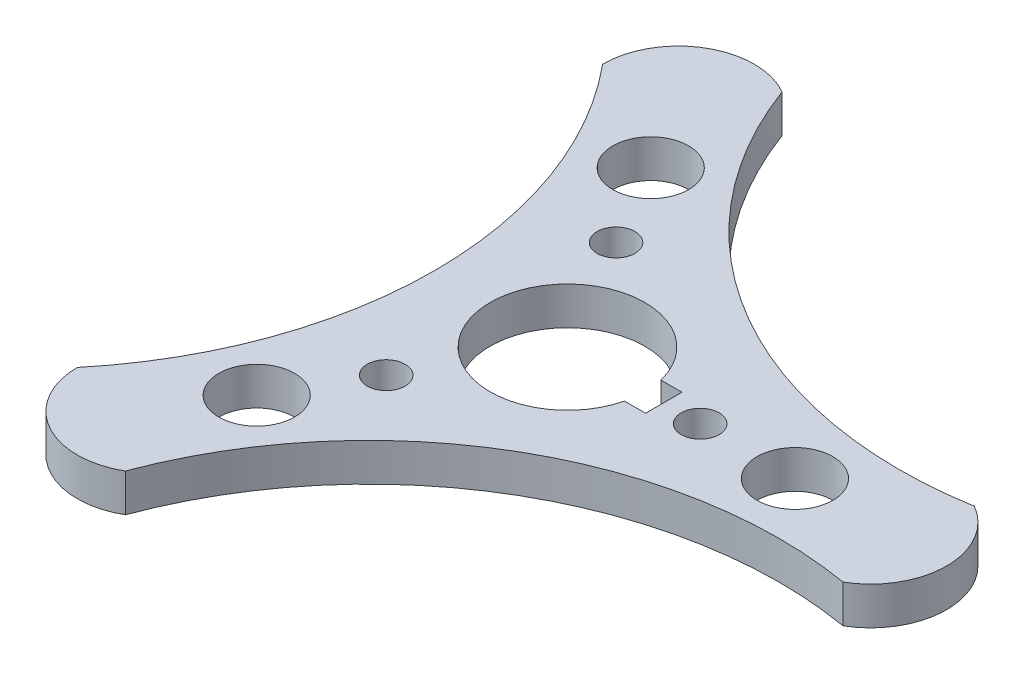
from build123d import *

# Parameters (mm, degrees)
BOSS_EXTRUDE2_DEPTH = 3.175


with BuildPart() as part:
    # Sketch1 → Boss-Extrude2 (new body)
    # profile 1 of 7: a face of its own
    with BuildSketch(Plane(origin=(0, 0, 0), x_dir=(1, 0, 0), z_dir=(0, 1, 0))):
        with BuildLine():
            ThreePointArc((28.575, -5.499261314), (31.75, 0), (28.575, 5.499261314))
            ThreePointArc((28.575, 5.499261314), (5.55625, 9.6237073), (-9.525, 27.49630657))
            ThreePointArc((-9.525, 27.49630657), (-15.875, 27.49630657), (-19.05, 21.997045256))
            ThreePointArc((-19.05, 21.997045256), (-11.443597622, 4.764679711), (-14.037901317, -13.892259152))
            Line((-14.037901317, -13.892259152), (-12.274630657, -14.910283942))
            ThreePointArc((-12.274630657, -14.910283942), (-11.1125, -13.748153285), (-9.525, -13.322783942))
            Line((-9.525, -13.322783942), (-9.525, 13.322783942))
            ThreePointArc((-9.525, 13.322783942), (-11.77006403, 18.742847972), (-6.35, 16.497783942))
            ThreePointArc((-6.35, 16.497783942), (-6.458185502, 15.676033474), (-6.775369343, 14.910283942))
            Line((-6.775369343, 14.910283942), (16.300369343, 1.5875))
            ThreePointArc((16.300369343, 1.5875), (19.871750468, 3.066814498), (22.225, 0))
            ThreePointArc((22.225, 0), (19.871750468, -3.066814498), (16.300369343, -1.5875))
            Line((16.300369343, -1.5875), (-6.775369343, -14.910283942))
            ThreePointArc((-6.775369343, -14.910283942), (-6.458185502, -15.676033474), (-6.35, -16.497783942))
            ThreePointArc((-6.35, -16.497783942), (-6.458185502, -17.31953441), (-6.775369343, -18.085283942))
            Line((-6.775369343, -18.085283942), (-5.012098683, -19.103308732))
            ThreePointArc((-5.012098683, -19.103308732), (9.848132482, -7.528106395), (28.575, -5.499261314))
        make_face()
    # profile 2 of 7: a face of its own
    with BuildSketch(Plane(origin=(0, 0, 0), x_dir=(1, 0, 0), z_dir=(0, 1, 0))):
        with BuildLine():
            ThreePointArc((-9.525, -27.49630657), (-7.560164077, -23.143006881), (-5.012098683, -19.103308732))
            Line((-5.012098683, -19.103308732), (-6.775369343, -18.085283942))
            ThreePointArc((-6.775369343, -18.085283942), (-11.1125, -19.247414599), (-12.274630657, -14.910283942))
            Line((-12.274630657, -14.910283942), (-14.037901317, -13.892259152))
            ThreePointArc((-14.037901317, -13.892259152), (-16.262349841, -18.118797588), (-19.05, -21.997045256))
            ThreePointArc((-19.05, -21.997045256), (-15.875, -27.49630657), (-9.525, -27.49630657))
        make_face()
    # profile 3 of 7: a face of its own
    with BuildSketch(Plane(origin=(0, 0, 0), x_dir=(1, 0, 0), z_dir=(0, 1, 0))):
        with BuildLine():
            Line((-9.525, 13.322783942), (-9.525, -13.322783942))
            ThreePointArc((-9.525, -13.322783942), (-7.9375, -13.748153285), (-6.775369343, -14.910283942))
            Line((-6.775369343, -14.910283942), (16.300369343, -1.5875))
            ThreePointArc((16.300369343, -1.5875), (15.875, 0), (16.300369343, 1.5875))
            Line((16.300369343, 1.5875), (-6.775369343, 14.910283942))
            ThreePointArc((-6.775369343, 14.910283942), (-7.9375, 13.748153285), (-9.525, 13.322783942))
        make_face()
        with BuildLine():
            Line((-8.065819658, -1.523195628), (-8.065819658, 1.523195628))
            Line((-8.065819658, 1.523195628), (-6.298644043, 1.523195628))
            ThreePointArc((-6.298644043, 1.523195628), (-5.996260328, 2.457214638), (-5.55625, 3.334835474))
            Line((-5.55625, 3.334835474), (-5.55625, 8.0362073))
            ThreePointArc((-5.55625, 8.0362073), (-6.678782015, 10.746239315), (-3.96875, 9.6237073))
            ThreePointArc((-3.96875, 9.6237073), (-4.022842751, 9.212832065), (-4.181434671, 8.8299573))
            Line((-4.181434671, 8.8299573), (-0.109927238, 6.479271387))
            ThreePointArc((-0.109927238, 6.479271387), (3.240101916, 5.61202114), (5.666177238, 3.144435913))
            Line((5.666177238, 3.144435913), (9.737684671, 0.79375))
            ThreePointArc((9.737684671, 0.79375), (11.523375234, 1.533407249), (12.7, 0))
            ThreePointArc((12.7, 0), (11.523375234, -1.533407249), (9.737684671, -0.79375))
            Line((9.737684671, -0.79375), (5.666177238, -3.144435913))
            ThreePointArc((5.666177238, -3.144435913), (3.240101916, -5.61202114), (-0.109927238, -6.479271387))
            Line((-0.109927238, -6.479271387), (-4.181434671, -8.8299573))
            ThreePointArc((-4.181434671, -8.8299573), (-4.022842751, -9.212832065), (-3.96875, -9.6237073))
            ThreePointArc((-3.96875, -9.6237073), (-6.678782015, -10.746239315), (-5.55625, -8.0362073))
            Line((-5.55625, -8.0362073), (-5.55625, -3.334835474))
            ThreePointArc((-5.55625, -3.334835474), (-5.996260328, -2.457214638), (-6.298644043, -1.523195628))
            Line((-6.298644043, -1.523195628), (-8.065819658, -1.523195628))
        make_face(mode=Mode.SUBTRACT)
    # profile 4 of 7: a face of its own
    with BuildSketch(Plane(origin=(0, 0, 0), x_dir=(1, 0, 0), z_dir=(0, 1, 0))):
        with BuildLine():
            Line((-5.55625, 8.0362073), (-5.55625, 3.334835474))
            ThreePointArc((-5.55625, 3.334835474), (-3.240101916, 5.61202114), (-0.109927238, 6.479271387))
            Line((-0.109927238, 6.479271387), (-4.181434671, 8.8299573))
            ThreePointArc((-4.181434671, 8.8299573), (-4.7625, 8.248891971), (-5.55625, 8.0362073))
        make_face()
    # profile 5 of 7: a face of its own
    with BuildSketch(Plane(origin=(0, 0, 0), x_dir=(1, 0, 0), z_dir=(0, 1, 0))):
        with BuildLine():
            ThreePointArc((-0.109927238, -6.479271387), (-3.240101916, -5.61202114), (-5.55625, -3.334835474))
            Line((-5.55625, -3.334835474), (-5.55625, -8.0362073))
            ThreePointArc((-5.55625, -8.0362073), (-4.7625, -8.248891971), (-4.181434671, -8.8299573))
            Line((-4.181434671, -8.8299573), (-0.109927238, -6.479271387))
        make_face()
    # profile 6 of 7: a face of its own
    with BuildSketch(Plane(origin=(0, 0, 0), x_dir=(1, 0, 0), z_dir=(0, 1, 0))):
        with BuildLine():
            ThreePointArc((5.666177238, 3.144435913), (6.037080593, 2.355143226), (6.298644043, 1.523195628))
            Line((6.298644043, 1.523195628), (8.065819658, 1.523195628))
            Line((8.065819658, 1.523195628), (8.065819658, -1.523195628))
            Line((8.065819658, -1.523195628), (6.298644043, -1.523195628))
            ThreePointArc((6.298644043, -1.523195628), (6.037080593, -2.355143226), (5.666177238, -3.144435913))
            Line((5.666177238, -3.144435913), (9.737684671, -0.79375))
            ThreePointArc((9.737684671, -0.79375), (9.525, 0), (9.737684671, 0.79375))
            Line((9.737684671, 0.79375), (5.666177238, 3.144435913))
        make_face()
    # profile 7 of 7: a face of its own
    with BuildSketch(Plane(origin=(0, 0, 0), x_dir=(1, 0, 0), z_dir=(0, 1, 0))):
        with BuildLine():
            Line((-6.298644043, 1.523195628), (-8.065819658, 1.523195628))
            Line((-8.065819658, 1.523195628), (-8.065819658, -1.523195628))
            Line((-8.065819658, -1.523195628), (-6.298644043, -1.523195628))
            ThreePointArc((-6.298644043, -1.523195628), (-6.480203832, 0), (-6.298644043, 1.523195628))
        make_face()
    extrude(amount=BOSS_EXTRUDE2_DEPTH)


solid = part.part
